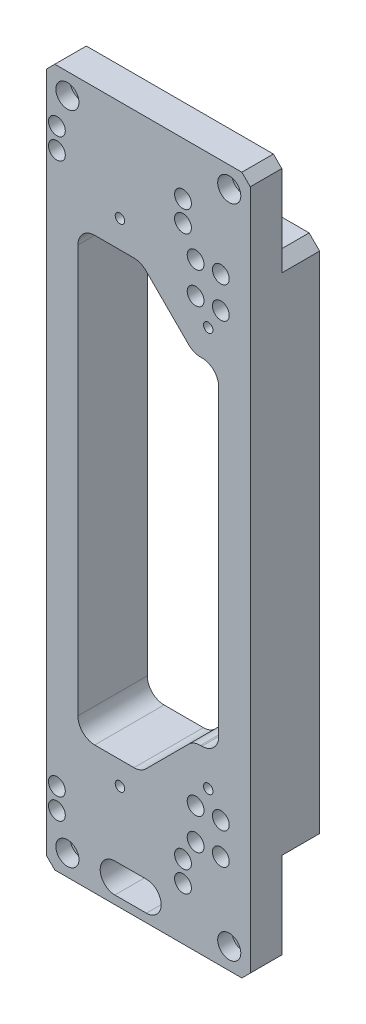
from build123d import *

# Parameters (mm, degrees)
SKETCH1_W                                            = 97
SKETCH1_H                                            = 292
BOSS_EXTRUDE1_DEPTH                                  = 18
SKETCH2_W                                            = 27
SKETCH2_H                                            = 20
SKETCH2_H_2                                          = 22
CUT_EXTRUDE1_DEPTH                                   = 155.894318811
SKETCH3_W                                            = 97
SKETCH3_H                                            = 332
BOSS_EXTRUDE2_DEPTH                                  = 15
CHAMFER1_SIZE                                        = 5
FILLET1_R                                            = 5
CUT_EXTRUDE2_DEPTH                                   = 174.874236159
CBORE_FOR_M4_HEXAGON_SOCKET_HEAD_CAP_SCR_D           = 4.5
CBORE_FOR_M4_HEXAGON_SOCKET_HEAD_CAP_SCR_CBORE_D     = 8
CBORE_FOR_M4_HEXAGON_SOCKET_HEAD_CAP_SCR_CBORE_DEPTH = 8
M4_CLEARANCE_HOLE1_D                                 = 4.5
CBORE_FOR_M6_SLOTTED_CHEESE_HEAD_SCREWS2_D           = 6.6
CBORE_FOR_M6_SLOTTED_CHEESE_HEAD_SCREWS2_CBORE_D     = 11
CBORE_FOR_M6_SLOTTED_CHEESE_HEAD_SCREWS2_CBORE_DEPTH = 6.8
CHAMFER2_SIZE                                        = 4
CUT_EXTRUDE3_DEPTH                                   = 177.060358968
FILLET4_R                                            = 8
SKETCH13_W                                           = 6
SKETCH13_H                                           = 175
CUT_EXTRUDE4_DEPTH                                   = 15
FILLET5_R                                            = 3


with BuildPart() as part:
    # Sketch1 → Boss-Extrude1 (new body)
    with BuildSketch(Plane.XY):
        Rectangle(SKETCH1_W, SKETCH1_H)
    extrude(amount=BOSS_EXTRUDE1_DEPTH)

    # Sketch2 → Cut-Extrude1 (cut, through all)
    with BuildSketch(Plane(origin=(0, 0, 0), x_dir=(-1, 0, 0), z_dir=(0, 0, -1))):
        with Locations((-35, -136)):
            Rectangle(SKETCH2_W, SKETCH2_H)
        with Locations((-35, 135)):
            Rectangle(SKETCH2_W, SKETCH2_H_2)
    extrude(amount=-CUT_EXTRUDE1_DEPTH, mode=Mode.SUBTRACT)

    # Sketch3 → Boss-Extrude2 (add)
    with BuildSketch(Plane.XY.offset(18)):
        Rectangle(SKETCH3_W, SKETCH3_H)
    extrude(amount=BOSS_EXTRUDE2_DEPTH)

    # Chamfer1
    chamfer1_edges = [part.edges().sort_by_distance(p)[0] for p in [
        (48.5, -126, 9),
        (21.5, -146, 9),
        (48.5, 124, 9),
        (21.5, 146, 9),
        (-48.5, 146, 9),
        (-48.5, -146, 9),
    ]]
    chamfer(chamfer1_edges, length=CHAMFER1_SIZE)

    # Fillet1
    fillet1_edges = [part.edges().sort_by_distance(p)[0] for p in [
        (21.5, -126, 9),
        (21.5, 124, 9),
    ]]
    fillet(fillet1_edges, radius=FILLET1_R)

    # Sketch4 → Cut-Extrude2 (cut, through all)
    with BuildSketch(Plane(origin=(0, 0, 18), x_dir=(-1, 0, 0), z_dir=(0, 0, -1))):
        with BuildLine():
            Line((0.9, -148), (15.9, -148))
            ThreePointArc((15.9, -148), (22.9, -155), (15.9, -162))
            Line((15.9, -162), (0.9, -162))
            ThreePointArc((0.9, -162), (-6.1, -155), (0.9, -148))
        make_face()
    extrude(amount=-CUT_EXTRUDE2_DEPTH, mode=Mode.SUBTRACT)

    # CBORE for M4 Hexagon socket head cap screws1 (through all)
    with Locations(Plane.XY.offset(33)):
        with Locations((-43.5, -141), (-43.5, -131), (16.5, -131), (16.5, -141), (16.5, 141), (16.5, 131), (-43.5, 131), (-43.5, 141), (22.5, -121), (34.5, -121), (22.5, -106), (34.5, -106), (34.5, 104), (22.5, 104), (34.5, 119), (22.5, 119)):
            CounterBoreHole(CBORE_FOR_M4_HEXAGON_SOCKET_HEAD_CAP_SCR_D / 2, CBORE_FOR_M4_HEXAGON_SOCKET_HEAD_CAP_SCR_CBORE_D / 2, CBORE_FOR_M4_HEXAGON_SOCKET_HEAD_CAP_SCR_CBORE_DEPTH)

    # M4 Clearance Hole1 (through all)
    with Locations(Plane.XY.offset(33)):
        with Locations((28.5, -96), (-13.5, -116), (28.5, 94), (-13.5, 118)):
            Hole(M4_CLEARANCE_HOLE1_D / 2)

    # CBORE for M6 Slotted cheese head screws2 (through all)
    with Locations(Plane.XY.offset(33)):
        with Locations((-38.5, 156), (-38.5, -156), (38.5, -156), (38.5, 156)):
            CounterBoreHole(CBORE_FOR_M6_SLOTTED_CHEESE_HEAD_SCREWS2_D / 2, CBORE_FOR_M6_SLOTTED_CHEESE_HEAD_SCREWS2_CBORE_D / 2, CBORE_FOR_M6_SLOTTED_CHEESE_HEAD_SCREWS2_CBORE_DEPTH)

    # Chamfer2
    chamfer2_edges = [part.edges().sort_by_distance(p)[0] for p in [
        (-48.5, 166, 25.5),
        (-48.5, -166, 25.5),
        (48.5, -166, 25.5),
        (48.5, 166, 25.5),
    ]]
    chamfer(chamfer2_edges, length=CHAMFER2_SIZE)

    # Sketch12 → Cut-Extrude3 (cut, through all)
    with BuildSketch(Plane.XY.offset(33)):
        Polygon((-33.5, -105), (-33.5, 105), (-3.5, 105), (21.5, 80), (33.5, 80), (33.5, -80), (21.5, -80), (-3.5, -105), align=None)
    extrude(amount=-CUT_EXTRUDE3_DEPTH, mode=Mode.SUBTRACT)

    # Fillet4
    fillet4_edges = [part.edges().sort_by_distance(p)[0] for p in [
        (-33.5, 105, 16.5),
        (-3.5, 105, 16.5),
        (21.5, 80, 16.5),
        (33.5, 80, 16.5),
        (33.5, -80, 16.5),
        (21.5, -80, 16.5),
        (-3.5, -105, 16.5),
        (-33.5, -105, 16.5),
    ]]
    fillet(fillet4_edges, radius=FILLET4_R)

    # Sketch13 → Cut-Extrude4 (cut)
    with BuildSketch(Plane(origin=(0, 0, 0), x_dir=(-1, 0, 0), z_dir=(0, 0, -1))):
        with Locations((45.5, 0)):
            Rectangle(SKETCH13_W, SKETCH13_H)
    extrude(amount=-CUT_EXTRUDE4_DEPTH, mode=Mode.SUBTRACT)

    # Fillet5
    fillet5_edges = [part.edges().sort_by_distance(p)[0] for p in [
        (-42.5, -87.5, 7.5),
        (-42.5, 87.5, 7.5),
    ]]
    fillet(fillet5_edges, radius=FILLET5_R)


solid = part.part
